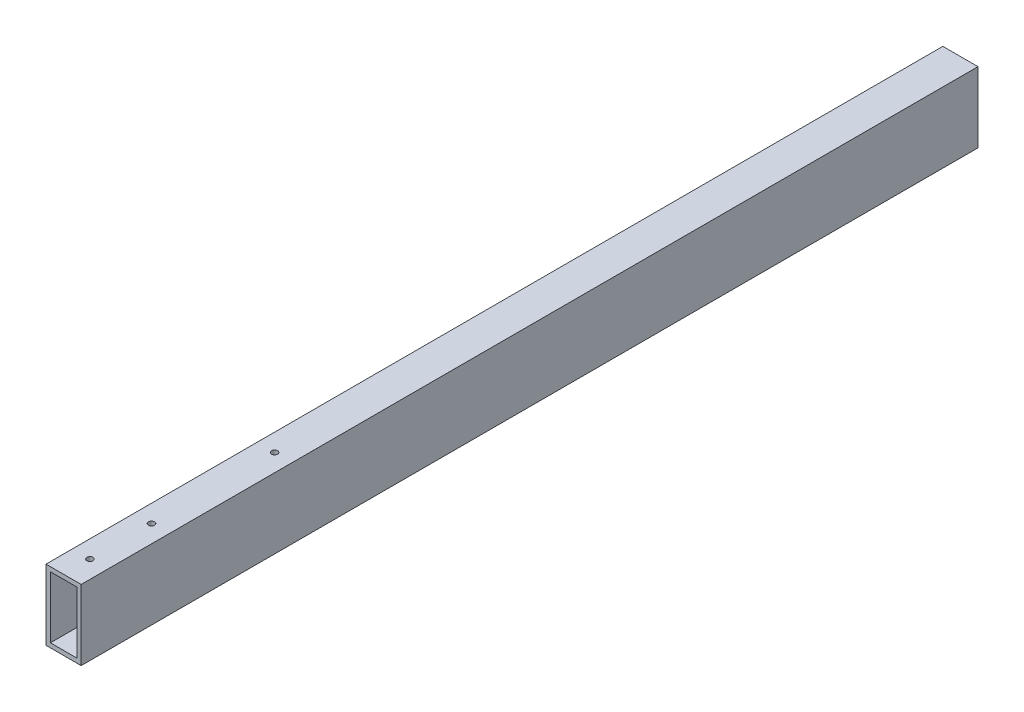
from build123d import *

# Parameters (mm, degrees)
SKETCH1_W           = 25.4
SKETCH1_H           = 50.8
SKETCH1_W_2         = 19.05
SKETCH1_H_2         = 44.45
BOSS_EXTRUDE1_DEPTH = 323.85
CUT_EXTRUDE1_REACH  = 330.056
SKETCH2_R           = 2.1971


with BuildPart() as part:
    # Sketch1 → Boss-Extrude1 (new, symmetric)
    with BuildSketch(Plane.XY):
        Rectangle(SKETCH1_W, SKETCH1_H)
        Rectangle(SKETCH1_W_2, SKETCH1_H_2, mode=Mode.SUBTRACT)
    extrude(amount=BOSS_EXTRUDE1_DEPTH, both=True)

    # Cut-Extrude1: up to this face of the body (flat: up to its plane)
    cut_extrude1_end = Plane(part.part.faces().sort_by_distance((0, -25.4, 0))[0])
    # Sketch2 → Cut-Extrude1 (cut, up to the picked face)
    with BuildSketch(Plane(origin=(0, 25.4, 0), x_dir=(1, 0, 0), z_dir=(0, 1, 0)), mode=Mode.PRIVATE) as cut_extrude1_sk1:
        with Locations(Location((8.2464e-05, -304.8, 0), (0, 0, 270))):
            Circle(SKETCH2_R)
    cut_extrude1_tool1 = split(extrude(cut_extrude1_sk1.sketch, amount=-CUT_EXTRUDE1_REACH, mode=Mode.PRIVATE), bisect_by=cut_extrude1_end, keep=Keep.BOTH, mode=Mode.PRIVATE)
    # Sketch2 → Cut-Extrude1 (cut, up to the picked face)
    with BuildSketch(Plane(origin=(0, 25.4, 0), x_dir=(1, 0, 0), z_dir=(0, 1, 0)), mode=Mode.PRIVATE) as cut_extrude1_sk2:
        with Locations(Location((8.2464e-05, -260.35, 0), (0, 0, 270))):
            Circle(SKETCH2_R)
    cut_extrude1_tool2 = split(extrude(cut_extrude1_sk2.sketch, amount=-CUT_EXTRUDE1_REACH, mode=Mode.PRIVATE), bisect_by=cut_extrude1_end, keep=Keep.BOTH, mode=Mode.PRIVATE)
    # Sketch2 → Cut-Extrude1 (cut, up to the picked face)
    with BuildSketch(Plane(origin=(0, 25.4, 0), x_dir=(1, 0, 0), z_dir=(0, 1, 0)), mode=Mode.PRIVATE) as cut_extrude1_sk3:
        with Locations(Location((8.2464e-05, -171.45, 0), (0, 0, 270))):
            Circle(SKETCH2_R)
    cut_extrude1_tool3 = split(extrude(cut_extrude1_sk3.sketch, amount=-CUT_EXTRUDE1_REACH, mode=Mode.PRIVATE), bisect_by=cut_extrude1_end, keep=Keep.BOTH, mode=Mode.PRIVATE)
    add(cut_extrude1_tool1.solids().sort_by(Axis((8.2e-05, 25.4, 304.8), (0, -1, 0)))[0], mode=Mode.SUBTRACT)
    add(cut_extrude1_tool2.solids().sort_by(Axis((8.2e-05, 25.4, 260.35), (0, -1, 0)))[0], mode=Mode.SUBTRACT)
    add(cut_extrude1_tool3.solids().sort_by(Axis((8.2e-05, 25.4, 171.45), (0, -1, 0)))[0], mode=Mode.SUBTRACT)


solid = part.part
